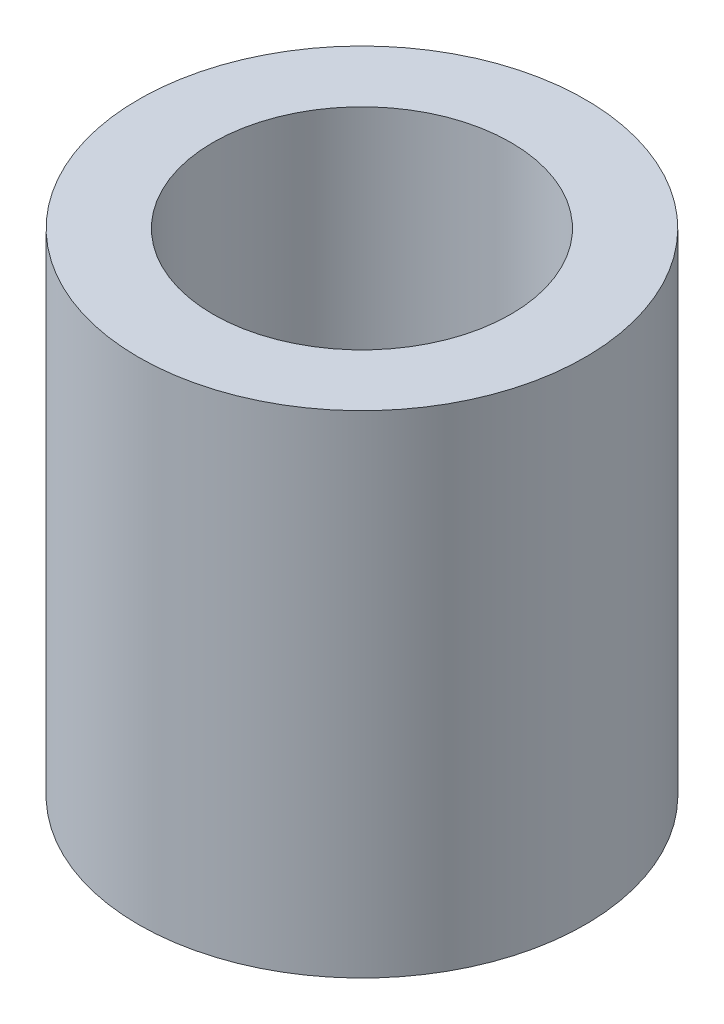
from build123d import *

# Parameters (mm, degrees)
SKETCH1_R           = 9.525
SKETCH1_R_2         = 6.35
BOSS_EXTRUDE1_DEPTH = 20.955


with BuildPart() as part:
    # Sketch1 → Boss-Extrude1 (new body)
    with BuildSketch(Plane(origin=(0, 0, 0), x_dir=(1, 0, 0), z_dir=(0, 1, 0))):
        with Locations(Location((0, 0, 0), (0, 0, 270))):
            Circle(SKETCH1_R)
        with Locations(Location((0, 0, 0), (0, 0, 270))):
            Circle(SKETCH1_R_2, mode=Mode.SUBTRACT)
    extrude(amount=BOSS_EXTRUDE1_DEPTH)


solid = part.part
